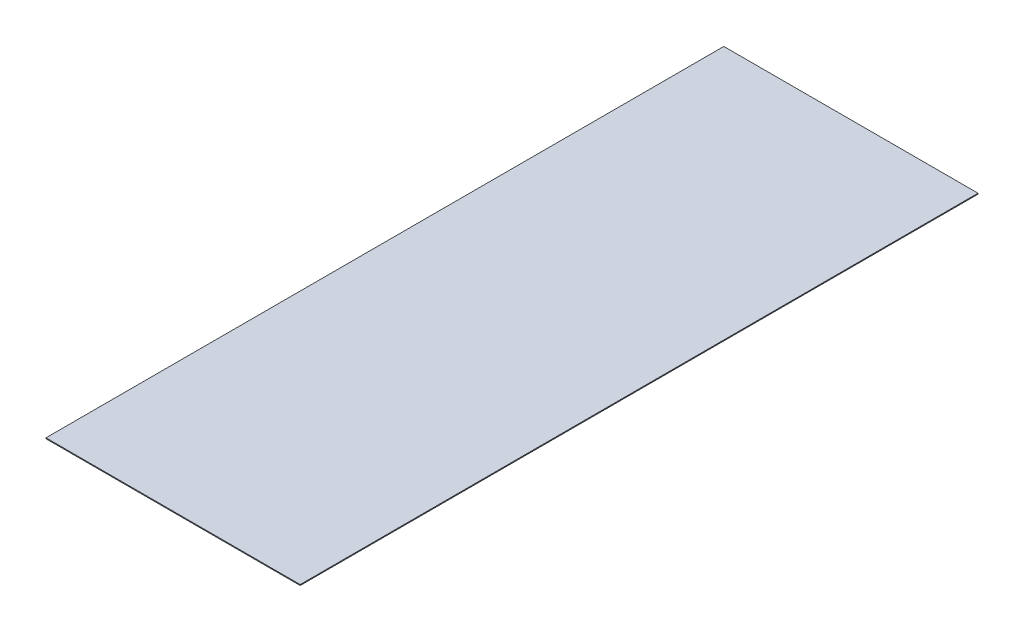
from build123d import *

# Parameters (mm, degrees)
CROQUIS1_W              = 914.4
CROQUIS1_H              = 2438.4
SALIENTE_EXTRUIR1_DEPTH = 3.2


with BuildPart() as part:
    # Croquis1 → Saliente-Extruir1 (new body)
    with BuildSketch(Plane(origin=(0, 0, 0), x_dir=(1, 0, 0), z_dir=(0, 1, 0))):
        Rectangle(CROQUIS1_W, CROQUIS1_H)
    extrude(amount=SALIENTE_EXTRUIR1_DEPTH)


solid = part.part
